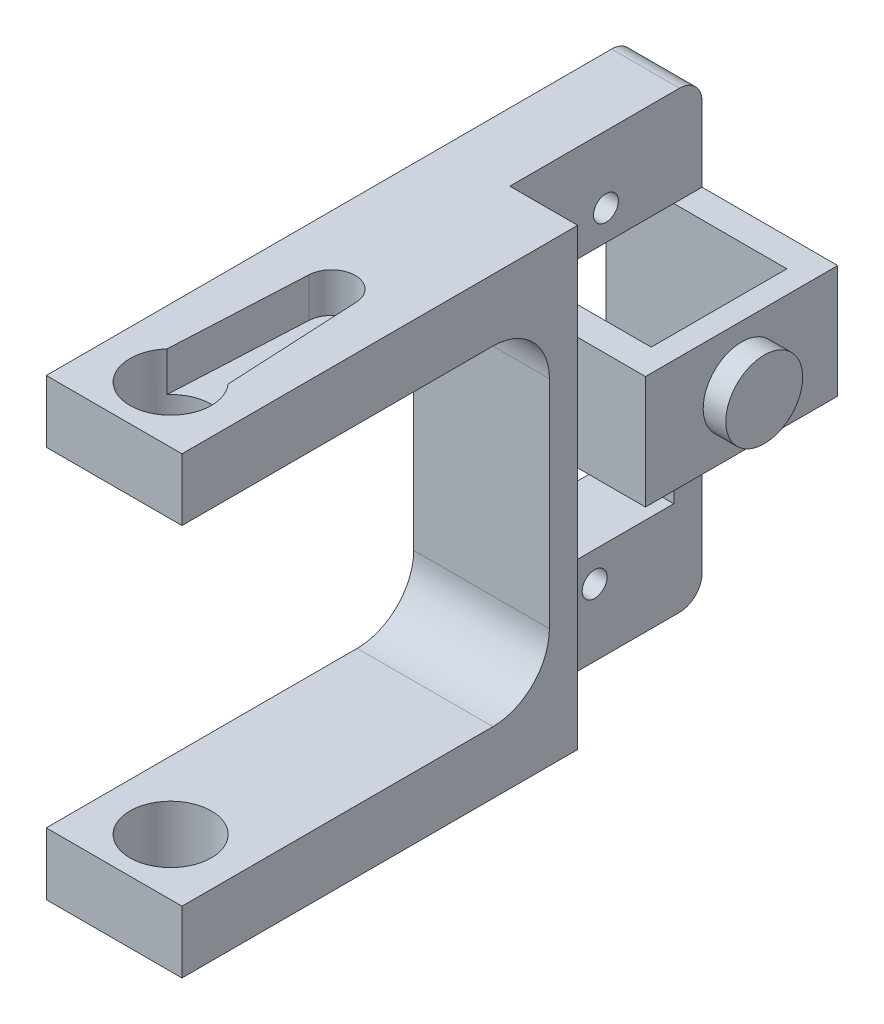
from build123d import *
from build123d.topology import SkipClean

# Parameters (mm, degrees)
SKETCH2_W             = 12
SKETCH2_H             = 5.5
BOSS_EXTRUDE2_DEPTH   = 35
BOSS_EXTRUDE2_2_DEPTH = 35
SKETCH2_3_W           = 12
SKETCH2_3_H           = 29.15
BOSS_EXTRUDE3_DEPTH   = 2.5
SKETCH7_W             = 6
SKETCH7_H             = 40.15
BOSS_EXTRUDE4_DEPTH   = 17
CUT_EXTRUDE5_REACH    = 51.94
SKETCH8_R             = 1.1
SKETCH8_W             = 12
SKETCH8_H             = 23
CUT_EXTRUDE6_DEPTH    = 3.5
SKETCH10_R            = 3.6
CUT_EXTRUDE7_DEPTH    = 54.966579755
FILLET6_R             = 5
FILLET7_R             = 5
SKETCH12_W            = 2.5
SKETCH12_H            = 10
BOSS_EXTRUDE5_DEPTH   = 10
SKETCH13_W            = 17
SKETCH13_H            = 10
BOSS_EXTRUDE6_DEPTH   = 2
SKETCH14_R            = 3.4
BOSS_EXTRUDE7_DEPTH   = 2
FILLET8_R             = 2
FILLET9_R             = 2


with BuildPart() as part:
    # Sketch2 → Boss-Extrude2 (new body)
    with BuildSketch(Plane.XY):
        with Locations((-2.681545395, 2.286493048)):
            Rectangle(SKETCH2_W, SKETCH2_H)
    extrude(amount=BOSS_EXTRUDE2_DEPTH)

    # Sketch2<3> → Boss-Extrude3 (add)
    with BuildSketch(Plane.XY):
        with Locations((-2.681545395, -15.038506952)):
            Rectangle(SKETCH2_3_W, SKETCH2_3_H)
    extrude(amount=BOSS_EXTRUDE3_DEPTH)



with BuildPart() as body_2:
    # Sketch2 → Boss-Extrude2 2 (new body)
    with BuildSketch(Plane.XY):
        with Locations((-2.681545395, -32.363506952)):
            Rectangle(SKETCH2_W, SKETCH2_H)
    extrude(amount=BOSS_EXTRUDE2_2_DEPTH)


with BuildPart() as part_1:
    add(part.part)

    add(body_2.part)  # Boss-Extrude4 merges body 2
    # Sketch7 → Boss-Extrude4 (add)
    with BuildSketch(Plane(origin=(0, 0, 0), x_dir=(-1, 0, 0), z_dir=(0, 0, -1))):
        with Locations((5.681545395, -15.038506952)):
            Rectangle(SKETCH7_W, SKETCH7_H)
    extrude(amount=BOSS_EXTRUDE4_DEPTH)

    # Sketch8 → Cut-Extrude5 (cut, up to next)
    with BuildSketch(Plane(origin=(-2.681545395, 0, 0), x_dir=(0, 0, -1), z_dir=(1, 0, 0)), mode=Mode.PRIVATE) as cut_extrude5_sk1:
        with Locations((8.5, -0.888506952)):
            Circle(SKETCH8_R)
    cut_extrude5_tool1 = extrude(cut_extrude5_sk1.sketch, amount=-CUT_EXTRUDE5_REACH, mode=Mode.PRIVATE) & part_1.part
    # Sketch8 → Cut-Extrude5 (cut, up to next)
    with BuildSketch(Plane(origin=(-2.681545395, 0, 0), x_dir=(0, 0, -1), z_dir=(1, 0, 0)), mode=Mode.PRIVATE) as cut_extrude5_sk2:
        with Locations((7.5, -29.188506952)):
            Circle(SKETCH8_R)
    cut_extrude5_tool2 = extrude(cut_extrude5_sk2.sketch, amount=-CUT_EXTRUDE5_REACH, mode=Mode.PRIVATE) & part_1.part
    # Sketch8 → Cut-Extrude5 (cut, up to next)
    with BuildSketch(Plane(origin=(-2.681545395, 0, 0), x_dir=(0, 0, -1), z_dir=(1, 0, 0)), mode=Mode.PRIVATE) as cut_extrude5_sk3:
        with Locations((8.5, -15.038506952)):
            Rectangle(SKETCH8_W, SKETCH8_H)
    cut_extrude5_tool3 = extrude(cut_extrude5_sk3.sketch, amount=-CUT_EXTRUDE5_REACH, mode=Mode.PRIVATE) & part_1.part
    add(cut_extrude5_tool1.solids().sort_by_distance((-2.681545, -0.888507, -8.5))[0], mode=Mode.SUBTRACT)
    add(cut_extrude5_tool2.solids().sort_by_distance((-2.681545, -29.188507, -7.5))[0], mode=Mode.SUBTRACT)
    add(cut_extrude5_tool3.solids().sort_by_distance((-2.681545, -15.038507, -8.5))[0], mode=Mode.SUBTRACT)

    # Sketch9 → Cut-Extrude6 (cut)
    with BuildSketch(Plane(origin=(0, 5.036493048, 0), x_dir=(1, 0, 0), z_dir=(0, 1, 0))):
        with BuildLine():
            Line((-0.584210872, -15.668774056), (0.018454605, -27.61882382))
            ThreePointArc((0.018454605, -27.61882382), (-2.681545395, -33.6), (-5.381545395, -27.61882382))
            Line((-5.381545395, -27.61882382), (-4.778879917, -15.668774056))
            ThreePointArc((-4.778879917, -15.668774056), (-2.681545395, -13.674546931), (-0.584210872, -15.668774056))
        make_face()
    extrude(amount=-CUT_EXTRUDE6_DEPTH, mode=Mode.SUBTRACT)

    # Sketch10 → Cut-Extrude7 (cut, through all)
    with BuildSketch(Plane(origin=(0, 5.036493048, 0), x_dir=(1, 0, 0), z_dir=(0, 1, 0))):
        with Locations((-2.681545395, -30)):
            Circle(SKETCH10_R)
    extrude(amount=-CUT_EXTRUDE7_DEPTH, mode=Mode.SUBTRACT)

    # Fillet6
    fillet6_edges = [part_1.edges().sort_by_distance(p)[0] for p in [
        (-2.681545395, -0.463506952, 2.5),
    ]]
    fillet(fillet6_edges, radius=FILLET6_R)

    # Fillet7
    fillet7_edges = [part_1.edges().sort_by_distance(p)[0] for p in [
        (-2.681545395, -29.613506952, 2.5),
    ]]
    fillet(fillet7_edges, radius=FILLET7_R)

    # Sketch12 → Boss-Extrude5 (add)
    with SkipClean():  # the faces are left unmerged after this step: merging them gives an invalid solid
        with BuildSketch(Plane(origin=(-2.681545395, 0, 0), x_dir=(0, 0, -1), z_dir=(1, 0, 0))):
            with Locations((1.25, -8.543506952)):
                Rectangle(SKETCH12_W, SKETCH12_H)
            with Locations((15.75, -8.543506952)):
                Rectangle(SKETCH12_W, SKETCH12_H)
        extrude(amount=BOSS_EXTRUDE5_DEPTH)

    # Sketch13 → Boss-Extrude6 (add)
    with SkipClean():  # the faces are left unmerged after this step: merging them gives an invalid solid
        with BuildSketch(Plane(origin=(7.318454605, 0, 0), x_dir=(0, 0, -1), z_dir=(1, 0, 0))):
            with Locations((8.5, -8.543506952)):
                Rectangle(SKETCH13_W, SKETCH13_H)
        extrude(amount=BOSS_EXTRUDE6_DEPTH)

    # Sketch14 → Boss-Extrude7 (add)
    with SkipClean():  # the faces are left unmerged after this step: merging them gives an invalid solid
        with BuildSketch(Plane(origin=(9.318454605, 0, 0), x_dir=(0, 0, -1), z_dir=(1, 0, 0))):
            with Locations((8.5, -8.543506952)):
                Circle(SKETCH14_R)
        extrude(amount=BOSS_EXTRUDE7_DEPTH)

    # Fillet8
    fillet8_edges = [part_1.edges().sort_by_distance(p)[0] for p in [
        (-5.681545395, 5.036493048, -17),
    ]]
    fillet(fillet8_edges, radius=FILLET8_R)

    # Fillet9
    fillet9_edges = [part_1.edges().sort_by_distance(p)[0] for p in [
        (-5.681545395, -35.113506952, -17),
    ]]
    fillet(fillet9_edges, radius=FILLET9_R)


solid = part_1.part
